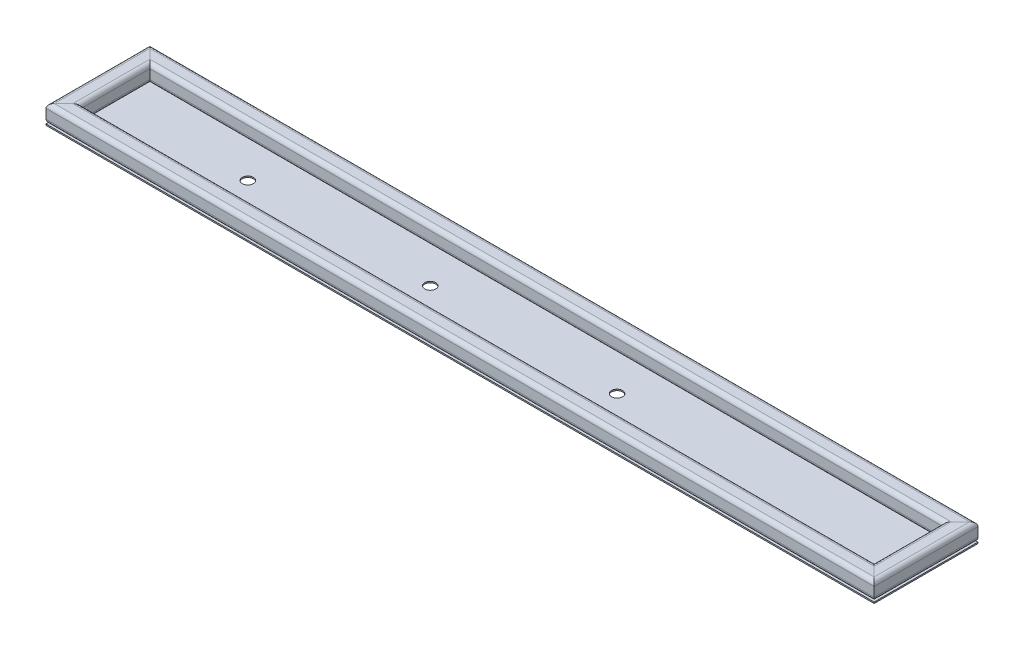
from build123d import *

# Parameters (mm, degrees)
TUBO_CUADRADO_2_X_2_X_0_25_1_DEPTH      = 186.921024484
TUBO_CUADRADO_2_X_2_X_0_25_1_DEPTH_BACK = 36.921024484
TUBO_CUADRADO_2_X_2_X_0_25_1_2_DEPTH    = 1270.242048969
TUBO_CUADRADO_2_X_2_X_0_25_1_3_DEPTH    = 223.842048969
TUBO_CUADRADO_2_X_2_X_0_25_1_4_DEPTH    = 1270.242048969
CROQUIS3_W                              = 1196.4
CROQUIS3_H                              = 150
SALIENTE_EXTRUIR1_DEPTH                 = 1.9
CROQUIS5_R                              = 7.9375
CORTAR_EXTRUIR1_DEPTH                   = 10


with BuildPart() as part:
    # Sketch1 → Tubo cuadrado 2 X 2 X 0.25(1) (new, two sides: drawn at the far end of the back side and taken through both)
    with BuildSketch(Plane(origin=(-585.5, 12.7, -75), x_dir=(1, 0, 0), z_dir=(0, 0, 1)).offset(-TUBO_CUADRADO_2_X_2_X_0_25_1_DEPTH_BACK)):
        with BuildLine():
            Line((-6.7, -12.7), (6.7, -12.7))
            ThreePointArc((6.7, -12.7), (10.942640687, -10.942640687), (12.7, -6.7))
            Line((12.7, -6.7), (12.7, 6.7))
            ThreePointArc((12.7, 6.7), (10.942640687, 10.942640687), (6.7, 12.7))
            Line((6.7, 12.7), (-6.7, 12.7))
            ThreePointArc((-6.7, 12.7), (-10.942640687, 10.942640687), (-12.7, 6.7))
            Line((-12.7, 6.7), (-12.7, -6.7))
            ThreePointArc((-12.7, -6.7), (-10.942640687, -10.942640687), (-6.7, -12.7))
        make_face()
        with BuildLine():
            Line((-6.7, -9.7), (6.7, -9.7))
            ThreePointArc((6.7, -9.7), (8.821320344, -8.821320344), (9.7, -6.7))
            Line((9.7, -6.7), (9.7, 6.7))
            ThreePointArc((9.7, 6.7), (8.821320344, 8.821320344), (6.7, 9.7))
            Line((6.7, 9.7), (-6.7, 9.7))
            ThreePointArc((-6.7, 9.7), (-8.821320344, 8.821320344), (-9.7, 6.7))
            Line((-9.7, 6.7), (-9.7, -6.7))
            ThreePointArc((-9.7, -6.7), (-8.821320344, -8.821320344), (-6.7, -9.7))
        make_face(mode=Mode.SUBTRACT)
    extrude(amount=TUBO_CUADRADO_2_X_2_X_0_25_1_DEPTH + TUBO_CUADRADO_2_X_2_X_0_25_1_DEPTH_BACK)

    # Tubo cuadrado 2 X 2 X 0.25(1) mitre 1
    split(bisect_by=Plane(origin=(-598.2, 0, -75), x_dir=(0, -1, 0), z_dir=(-0.707106781, 0, 0.707106781)), keep=Keep.TOP)

    # Tubo cuadrado 2 X 2 X 0.25(1) mitre 2
    split(bisect_by=Plane(origin=(-598.2, 0, 75), x_dir=(0, -1, 0), z_dir=(-0.707106781, 0, -0.707106781)), keep=Keep.TOP)


with BuildPart() as body_2:
    # Sketch1 on segment 2 (carried to segment 2) → Tubo cuadrado 2 X 2 X 0.25_1 2 (new body)
    with BuildSketch(Plane(origin=(-635.121024484, 12.7, 62.3), x_dir=(0, 0, -1), z_dir=(1, 0, 0))):
        with BuildLine():
            Line((-6.7, -12.7), (6.7, -12.7))
            ThreePointArc((6.7, -12.7), (10.942640687, -10.942640687), (12.7, -6.7))
            Line((12.7, -6.7), (12.7, 6.7))
            ThreePointArc((12.7, 6.7), (10.942640687, 10.942640687), (6.7, 12.7))
            Line((6.7, 12.7), (-6.7, 12.7))
            ThreePointArc((-6.7, 12.7), (-10.942640687, 10.942640687), (-12.7, 6.7))
            Line((-12.7, 6.7), (-12.7, -6.7))
            ThreePointArc((-12.7, -6.7), (-10.942640687, -10.942640687), (-6.7, -12.7))
        make_face()
        with BuildLine():
            Line((-6.7, -9.7), (6.7, -9.7))
            ThreePointArc((6.7, -9.7), (8.821320344, -8.821320344), (9.7, -6.7))
            Line((9.7, -6.7), (9.7, 6.7))
            ThreePointArc((9.7, 6.7), (8.821320344, 8.821320344), (6.7, 9.7))
            Line((6.7, 9.7), (-6.7, 9.7))
            ThreePointArc((-6.7, 9.7), (-8.821320344, 8.821320344), (-9.7, 6.7))
            Line((-9.7, 6.7), (-9.7, -6.7))
            ThreePointArc((-9.7, -6.7), (-8.821320344, -8.821320344), (-6.7, -9.7))
        make_face(mode=Mode.SUBTRACT)
    extrude(amount=TUBO_CUADRADO_2_X_2_X_0_25_1_2_DEPTH)

    # Tubo cuadrado 2 X 2 X 0.25_1 2 mitre 1
    split(bisect_by=Plane(origin=(-598.2, 0, 75), x_dir=(0, 1, 0), z_dir=(0.707106781, 0, 0.707106781)), keep=Keep.TOP)

    # Tubo cuadrado 2 X 2 X 0.25_1 2 mitre 2
    split(bisect_by=Plane(origin=(598.2, 0, 75), x_dir=(0, -1, 0), z_dir=(-0.707106781, 0, 0.707106781)), keep=Keep.TOP)


with BuildPart() as body_3:
    # Sketch1 on segment 3 (carried to segment 3) → Tubo cuadrado 2 X 2 X 0.25_1 3 (new body)
    with BuildSketch(Plane(origin=(585.5, 12.7, 111.921024484), x_dir=(-1, 0, 0), z_dir=(0, 0, -1))):
        with BuildLine():
            Line((-6.7, -12.7), (6.7, -12.7))
            ThreePointArc((6.7, -12.7), (10.942640687, -10.942640687), (12.7, -6.7))
            Line((12.7, -6.7), (12.7, 6.7))
            ThreePointArc((12.7, 6.7), (10.942640687, 10.942640687), (6.7, 12.7))
            Line((6.7, 12.7), (-6.7, 12.7))
            ThreePointArc((-6.7, 12.7), (-10.942640687, 10.942640687), (-12.7, 6.7))
            Line((-12.7, 6.7), (-12.7, -6.7))
            ThreePointArc((-12.7, -6.7), (-10.942640687, -10.942640687), (-6.7, -12.7))
        make_face()
        with BuildLine():
            Line((-6.7, -9.7), (6.7, -9.7))
            ThreePointArc((6.7, -9.7), (8.821320344, -8.821320344), (9.7, -6.7))
            Line((9.7, -6.7), (9.7, 6.7))
            ThreePointArc((9.7, 6.7), (8.821320344, 8.821320344), (6.7, 9.7))
            Line((6.7, 9.7), (-6.7, 9.7))
            ThreePointArc((-6.7, 9.7), (-8.821320344, 8.821320344), (-9.7, 6.7))
            Line((-9.7, 6.7), (-9.7, -6.7))
            ThreePointArc((-9.7, -6.7), (-8.821320344, -8.821320344), (-6.7, -9.7))
        make_face(mode=Mode.SUBTRACT)
    extrude(amount=TUBO_CUADRADO_2_X_2_X_0_25_1_3_DEPTH)

    # Tubo cuadrado 2 X 2 X 0.25_1 3 mitre 1
    split(bisect_by=Plane(origin=(598.2, 0, -75), x_dir=(0, 1, 0), z_dir=(0.707106781, 0, 0.707106781)), keep=Keep.TOP)

    # Tubo cuadrado 2 X 2 X 0.25_1 3 mitre 2
    split(bisect_by=Plane(origin=(598.2, 0, 75), x_dir=(0, 1, 0), z_dir=(0.707106781, 0, -0.707106781)), keep=Keep.TOP)


with BuildPart() as body_4:
    # Sketch1 on segment 4 (carried to segment 4) → Tubo cuadrado 2 X 2 X 0.25_1 4 (new body)
    with BuildSketch(Plane(origin=(635.121024484, 12.7, -62.3), x_dir=(0, 0, 1), z_dir=(-1, 0, 0))):
        with BuildLine():
            Line((-6.7, -12.7), (6.7, -12.7))
            ThreePointArc((6.7, -12.7), (10.942640687, -10.942640687), (12.7, -6.7))
            Line((12.7, -6.7), (12.7, 6.7))
            ThreePointArc((12.7, 6.7), (10.942640687, 10.942640687), (6.7, 12.7))
            Line((6.7, 12.7), (-6.7, 12.7))
            ThreePointArc((-6.7, 12.7), (-10.942640687, 10.942640687), (-12.7, 6.7))
            Line((-12.7, 6.7), (-12.7, -6.7))
            ThreePointArc((-12.7, -6.7), (-10.942640687, -10.942640687), (-6.7, -12.7))
        make_face()
        with BuildLine():
            Line((-6.7, -9.7), (6.7, -9.7))
            ThreePointArc((6.7, -9.7), (8.821320344, -8.821320344), (9.7, -6.7))
            Line((9.7, -6.7), (9.7, 6.7))
            ThreePointArc((9.7, 6.7), (8.821320344, 8.821320344), (6.7, 9.7))
            Line((6.7, 9.7), (-6.7, 9.7))
            ThreePointArc((-6.7, 9.7), (-8.821320344, 8.821320344), (-9.7, 6.7))
            Line((-9.7, 6.7), (-9.7, -6.7))
            ThreePointArc((-9.7, -6.7), (-8.821320344, -8.821320344), (-6.7, -9.7))
        make_face(mode=Mode.SUBTRACT)
    extrude(amount=TUBO_CUADRADO_2_X_2_X_0_25_1_4_DEPTH)

    # Tubo cuadrado 2 X 2 X 0.25_1 4 mitre 1
    split(bisect_by=Plane(origin=(-598.2, 0, -75), x_dir=(0, 1, 0), z_dir=(0.707106781, 0, -0.707106781)), keep=Keep.TOP)

    # Tubo cuadrado 2 X 2 X 0.25_1 4 mitre 2
    split(bisect_by=Plane(origin=(598.2, 0, -75), x_dir=(0, -1, 0), z_dir=(-0.707106781, 0, -0.707106781)), keep=Keep.TOP)


with BuildPart() as body_5:
    # Croquis3 → Saliente-Extruir1 (new body)
    with BuildSketch(Plane.XZ):
        Rectangle(CROQUIS3_W, CROQUIS3_H)
    extrude(amount=SALIENTE_EXTRUIR1_DEPTH)

    # Croquis5 → Cortar-Extruir1 (cut)
    with BuildSketch(Plane(origin=(0, 0, 0), x_dir=(1, 0, 0), z_dir=(0, 1, 0))):
        with Locations(Location((-381.572933, 0, 0), (0, 0, 180))):
            Circle(CROQUIS5_R)
        with Locations(Location((-118.072933, 0, 0), (0, 0, 180))):
            Circle(CROQUIS5_R)
        with Locations(Location((151.785097887, 0, 0), (0, 0, 180))):
            Circle(CROQUIS5_R)
    extrude(amount=-CORTAR_EXTRUIR1_DEPTH, mode=Mode.SUBTRACT)


solid = Compound([part.part, body_2.part, body_3.part, body_4.part, body_5.part])
